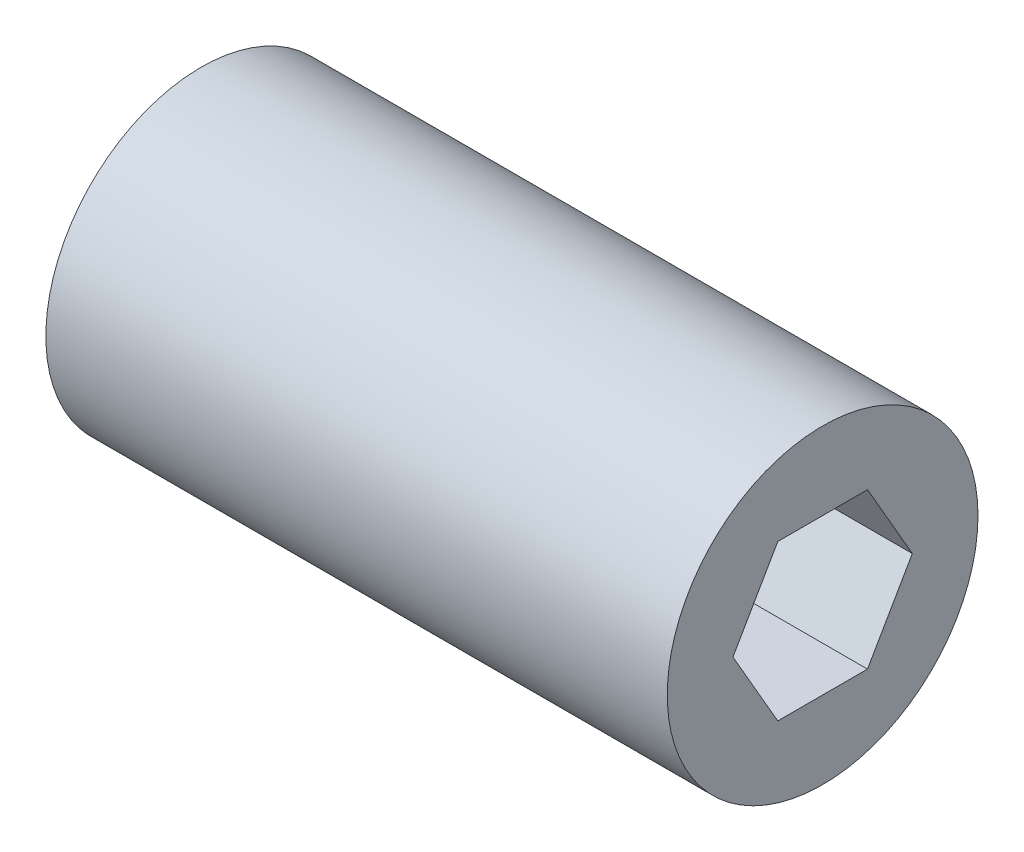
from build123d import *

# Parameters (mm, degrees)
SKETCH1_R           = 12.7
BOSS_EXTRUDE1_DEPTH = 25.4


with BuildPart() as part:
    # Sketch1 → Boss-Extrude1 (new, symmetric)
    with BuildSketch(Plane(origin=(0, 0, 0), x_dir=(0, 0, -1), z_dir=(1, 0, 0))):
        Circle(SKETCH1_R)
        Polygon((7.332348419, 0), (3.666174209, 6.35), (-3.666174209, 6.35), (-7.332348419, 0), (-3.666174209, -6.35), (3.666174209, -6.35), align=None, mode=Mode.SUBTRACT)
    extrude(amount=BOSS_EXTRUDE1_DEPTH, both=True)


solid = part.part
